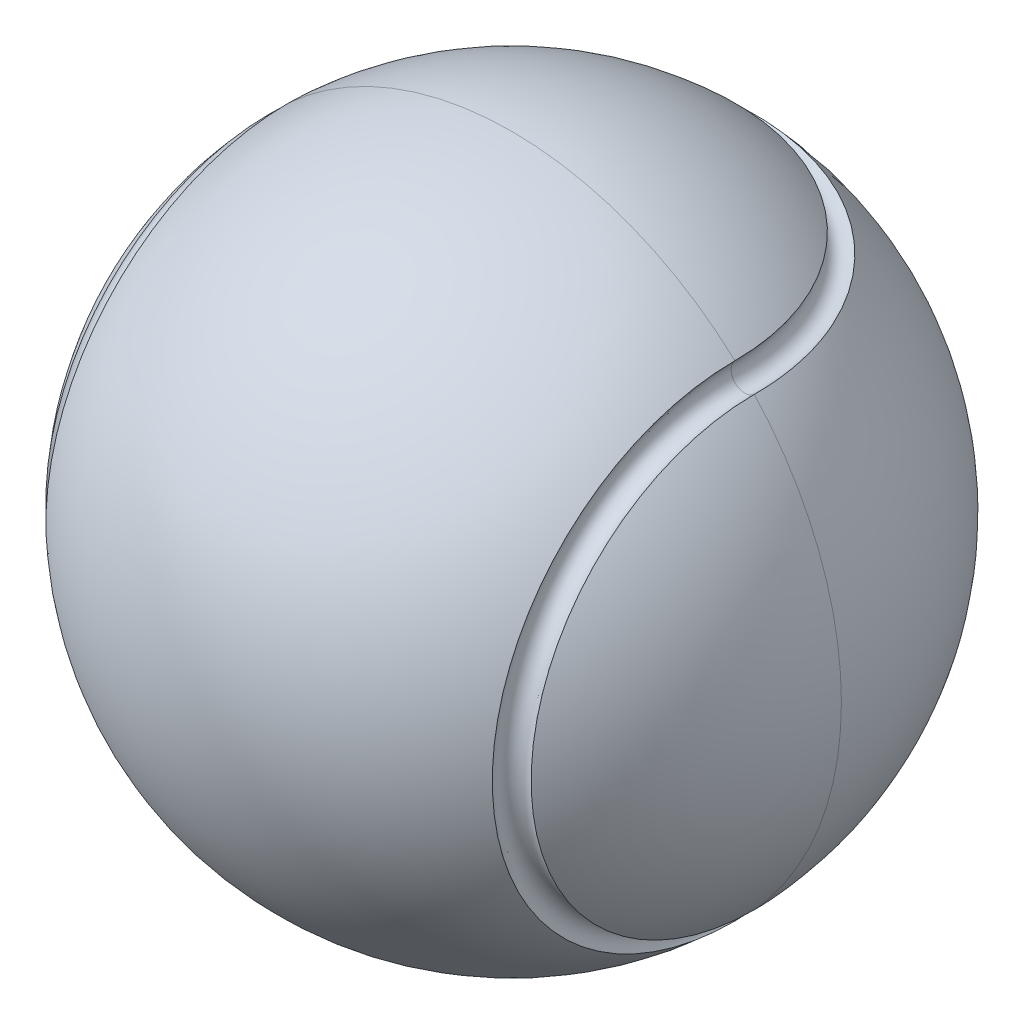
from build123d import *

# Parameters (mm, degrees)
CUT_SWEEP1_PROFILE_R = 3.175


with BuildPart() as part:
    # Sketch1 → Revolve1 (revolve)
    with BuildSketch(Plane.XY):
        with BuildLine():
            Line((-76.2, 0), (76.2, 0))
            ThreePointArc((76.2, 0), (0, 76.2), (-76.2, 0))
        make_face()
    revolve(axis=Axis((-76.2, 0, 0), (1, 0, 0)))

    # Cut-Sweep1: sweep along a curve in space
    with BuildLine() as cut_sweep1_path:
        ThreePointArc((-53.881536726, 53.881536726, 0), (-53.881536726, 0, 53.881536726), (-53.881536726, -53.881536726, 0))
        ThreePointArc((-53.881536726, -53.881536726, 0), (0, -53.881536726, -53.881536726), (53.881536726, -53.881536726, 0))
        ThreePointArc((53.881536726, -53.881536726, 0), (53.881536726, 0, 53.881536726), (53.881536726, 53.881536726, 0))
        ThreePointArc((53.881536726, 53.881536726, 0), (0, 53.881536726, -53.881536726), (-53.881536726, 53.881536726, 0))
    # Cut-Sweep1 profile (on start of the path) → Cut-Sweep1 (sweep, cut)
    with BuildSketch(Plane(origin=(-53.881536726, 53.881536726, 0), x_dir=(1, 0, 0), z_dir=(0, 0, 1))):
        Circle(CUT_SWEEP1_PROFILE_R)
    sweep(path=cut_sweep1_path.line, mode=Mode.SUBTRACT)


solid = part.part
